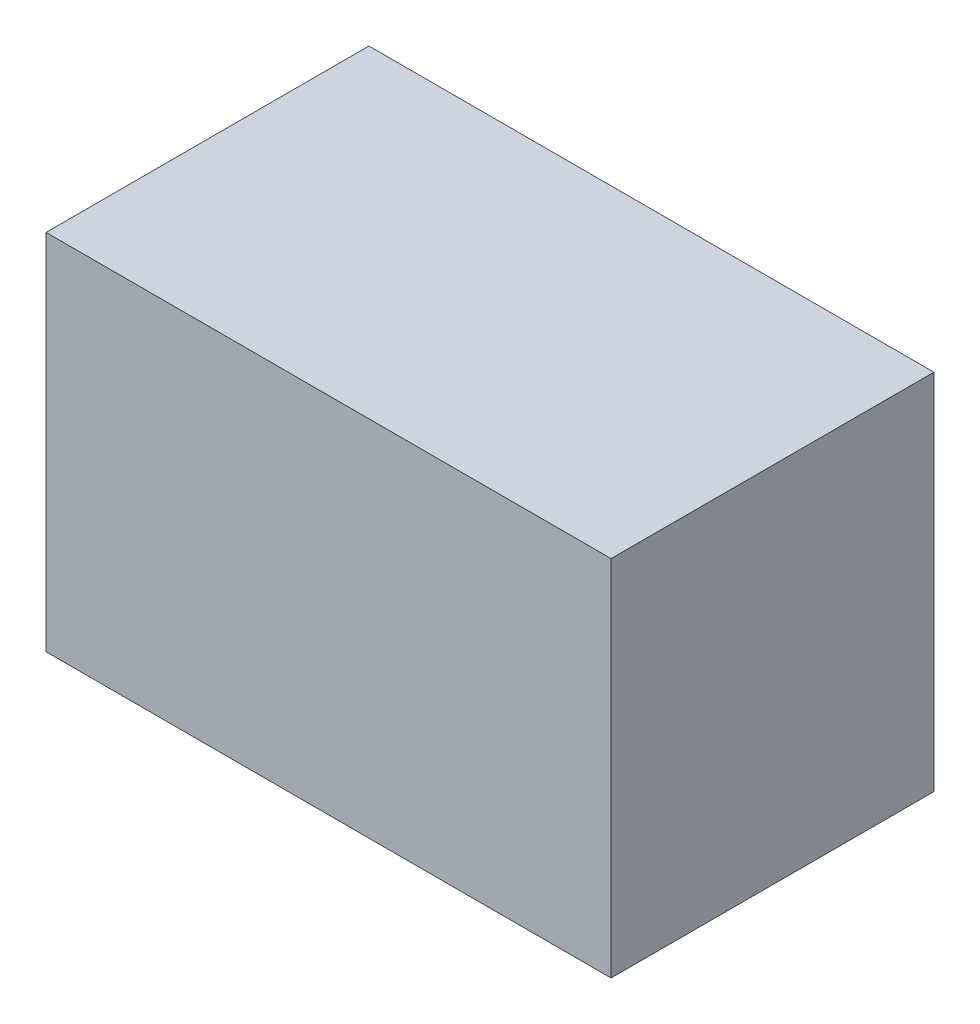
from build123d import *

# Parameters (mm, degrees)
SKETCH_1_W      = 70
SKETCH_1_H      = 45
EXTRUDE_1_DEPTH = 40


with BuildPart() as part:
    # 草图1 → 凸台-拉伸1 (new body)
    with BuildSketch(Plane.XY):
        with Locations((-24.512628357, -18.101043987)):
            Rectangle(SKETCH_1_W, SKETCH_1_H)
    extrude(amount=EXTRUDE_1_DEPTH)


solid = part.part
